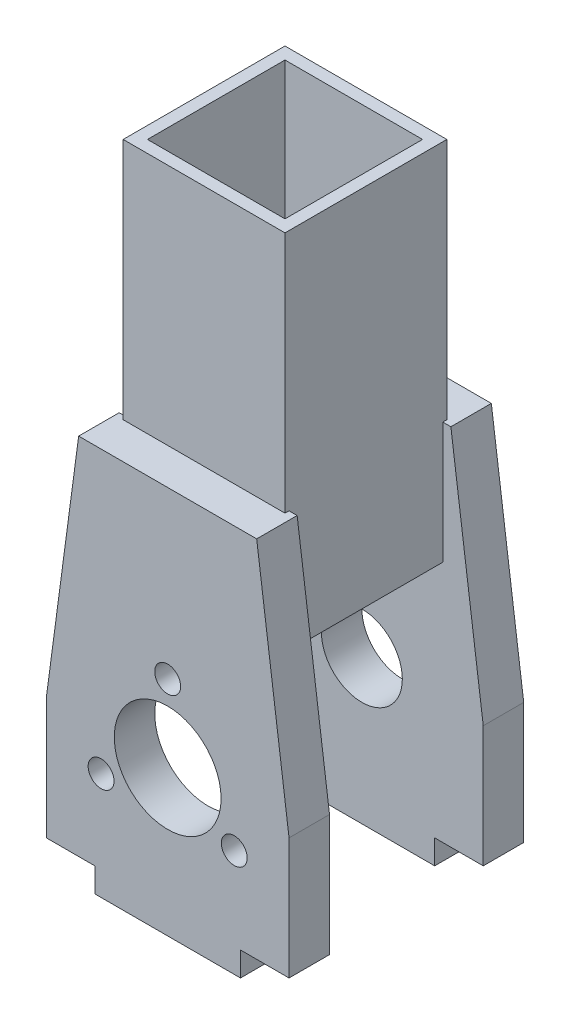
from build123d import *

# Parameters (mm, degrees)
SKETCH_4_R           = 6.6
SKETCH_4_R_2         = 1.6
EXTRUDE_1_DEPTH      = 5
SKETCH_7_R           = 5
EXTRUDE_2_DEPTH      = 5
EXTRUDE_3_DEPTH      = 30
EXTRUDE_3_DEPTH_BACK = 15
SKETCH_8_W           = 20
SKETCH_8_H           = 20
SKETCH_8_W_2         = 17
SKETCH_8_H_2         = 17


with BuildPart() as part:
    # ｽｹｯﾁ4 → ﾎﾞｽ - 押し出し1 (new body)
    with BuildSketch(Plane.XY.offset(9.5)):
        Polygon((-15, 0), (-9, 0), (-9, -3), (9, -3), (9, 0), (15, 0), (15, 15), (11, 45), (-11, 45), (-15, 15), align=None)
        with Locations((0, 15)):
            Circle(SKETCH_4_R, mode=Mode.SUBTRACT)
        with Locations((0, 24.5)):
            Circle(SKETCH_4_R_2, mode=Mode.SUBTRACT)
        with Locations((8.227241336, 10.25)):
            Circle(SKETCH_4_R_2, mode=Mode.SUBTRACT)
        with Locations((-8.227241336, 10.25)):
            Circle(SKETCH_4_R_2, mode=Mode.SUBTRACT)
    extrude(amount=EXTRUDE_1_DEPTH)


with BuildPart() as body_2:
    # ｽｹｯﾁ7 → ﾎﾞｽ - 押し出し2 (new body)
    with BuildSketch(Plane.XY.offset(-9.5)):
        Polygon((15, 0), (9, 0), (9, -3), (-9, -3), (-9, 0), (-15, 0), (-15, 15), (-11, 45), (11, 45), (15, 15), align=None)
        with Locations((0, 15)):
            Circle(SKETCH_7_R, mode=Mode.SUBTRACT)
    extrude(amount=-EXTRUDE_2_DEPTH)


with BuildPart() as body_3:
    # ｽｹｯﾁ8 → ﾎﾞｽ - 押し出し3 (new, two sides: drawn at the far end of the back side and taken through both)
    with BuildSketch(Plane(origin=(0, 45, 0), x_dir=(1, 0, 0), z_dir=(0, 1, 0)).offset(-EXTRUDE_3_DEPTH_BACK)):
        Rectangle(SKETCH_8_W, SKETCH_8_H)
        Rectangle(SKETCH_8_W_2, SKETCH_8_H_2, mode=Mode.SUBTRACT)
    extrude(amount=EXTRUDE_3_DEPTH + EXTRUDE_3_DEPTH_BACK)


solid = Compound([part.part, body_2.part, body_3.part])
